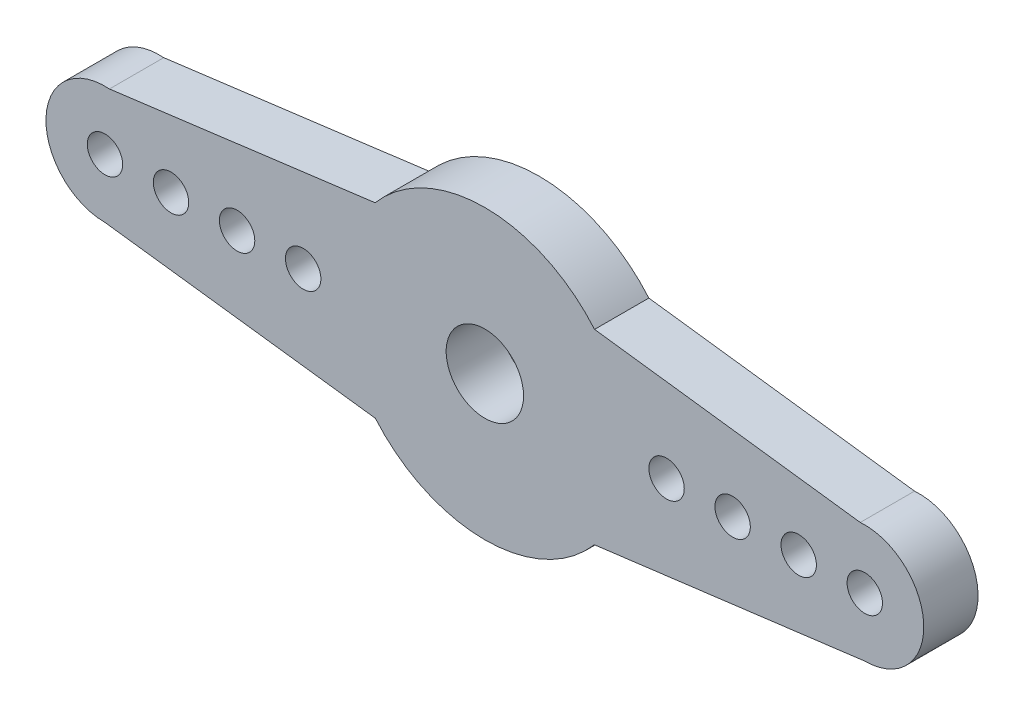
from build123d import *

# Parameters (mm, degrees)
SKETCH1_R           = 0.75
SKETCH1_R_2         = 1.64
BOSS_EXTRUDE1_DEPTH = 2.3


with BuildPart() as part:
    # Sketch1 → Boss-Extrude1 (new body)
    with BuildSketch(Plane.XY):
        with BuildLine():
            Line((-16.1, -2.500431312), (-4.640508927, -3.959252063))
            ThreePointArc((-4.640508927, -3.959252063), (0, -6.1), (4.640508927, -3.959252063))
            Line((4.640508927, -3.959252063), (16.1, -2.500431312))
            ThreePointArc((16.1, -2.500431312), (18.598607316, 0.095489412), (15.90916049, 2.493137988))
            Line((15.90916049, 2.493137988), (4.649322288, 3.948898867))
            ThreePointArc((4.649322288, 3.948898867), (0, 6.1), (-4.649322288, 3.948898867))
            Line((-4.649322288, 3.948898867), (-15.90916049, 2.493137988))
            ThreePointArc((-15.90916049, 2.493137988), (-18.598607316, 0.095489412), (-16.1, -2.500431312))
        make_face()
        with Locations((-16.1, 0)):
            Circle(SKETCH1_R, mode=Mode.SUBTRACT)
        with BuildLine():
            ThreePointArc((-12.55, 0), (-13.3, -0.75), (-14.05, 0))
            ThreePointArc((-14.05, 0), (-13.3, 0.75), (-12.55, 0))
        make_face(mode=Mode.SUBTRACT)
        with BuildLine():
            ThreePointArc((-9.75, 0), (-10.5, -0.75), (-11.25, 0))
            ThreePointArc((-11.25, 0), (-10.5, 0.75), (-9.75, 0))
        make_face(mode=Mode.SUBTRACT)
        with BuildLine():
            ThreePointArc((-6.95, 0), (-7.7, -0.75), (-8.45, 0))
            ThreePointArc((-8.45, 0), (-7.7, 0.75), (-6.95, 0))
        make_face(mode=Mode.SUBTRACT)
        Circle(SKETCH1_R_2, mode=Mode.SUBTRACT)
        with BuildLine():
            ThreePointArc((8.45, 0), (7.7, -0.75), (6.95, 0))
            ThreePointArc((6.95, 0), (7.7, 0.75), (8.45, 0))
        make_face(mode=Mode.SUBTRACT)
        with BuildLine():
            ThreePointArc((11.25, 0), (10.5, -0.75), (9.75, 0))
            ThreePointArc((9.75, 0), (10.5, 0.75), (11.25, 0))
        make_face(mode=Mode.SUBTRACT)
        with BuildLine():
            ThreePointArc((14.05, 0), (13.3, -0.75), (12.55, 0))
            ThreePointArc((12.55, 0), (13.3, 0.75), (14.05, 0))
        make_face(mode=Mode.SUBTRACT)
        with Locations((16.1, 0)):
            Circle(SKETCH1_R, mode=Mode.SUBTRACT)
    extrude(amount=BOSS_EXTRUDE1_DEPTH)


solid = part.part
